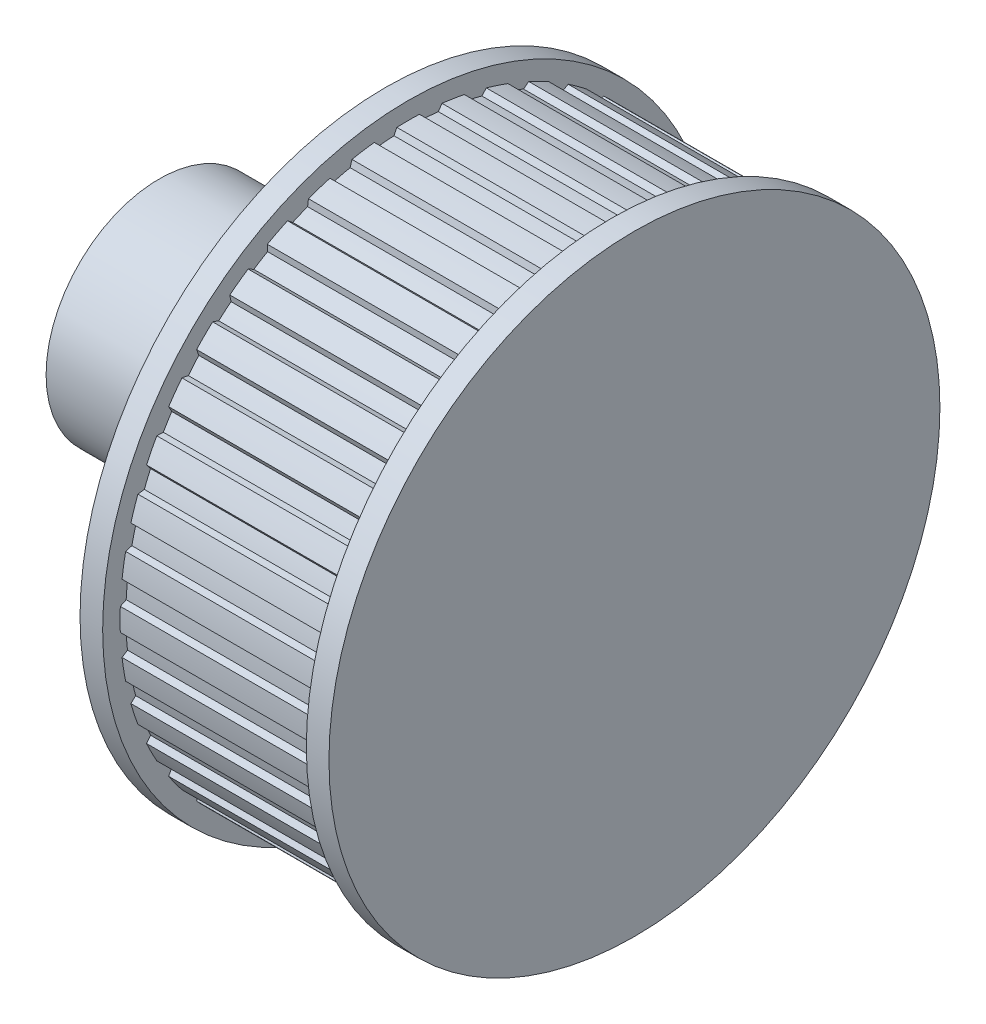
from build123d import *

# Parameters (mm, degrees)
BOSS_EXTRUDE1_DEPTH     = 9
SKETCH6_R               = 13.5
BOSS_EXTRUDE2_DEPTH     = 1
BOSS_EXTRUDE3_START     = -10
SKETCH6_3_R             = 13.5
BOSS_EXTRUDE3_DEPTH     = 1
SKETCH7_R               = 5
BOSS_EXTRUDE4_DEPTH     = 10
SKETCH8_R               = 3
CUT_EXTRUDE1_DEPTH      = 10
CUT_EXTRUDE2_REACH      = 27.407
CUT_EXTRUDE2_END_RADIUS = 3
SKETCH9_R               = 1.6


with BuildPart() as part:
    # Sketch5 → Boss-Extrude1 (new body)
    with BuildSketch(Plane(origin=(0, 0, 0), x_dir=(0, 0, -1), z_dir=(1, 0, 0))):
        with BuildLine():
            Line((-0.622813523, 12.459443339), (-0.499777455, 12.720185631))
            ThreePointArc((-0.499777455, 12.720185631), (0, 12.73), (0.499777455, 12.720185631))
            Line((0.499777455, 12.720185631), (0.622813523, 12.459443339))
            ThreePointArc((0.622813523, 12.459443339), (0.978777219, 12.436543738), (1.333940698, 12.403476416))
            Line((1.333940698, 12.403476416), (1.49625107, 12.641761457))
            ThreePointArc((1.49625107, 12.641761457), (1.99141074, 12.573272576), (2.483499799, 12.48539662))
            Line((2.483499799, 12.48539662), (2.564232009, 12.208617416))
            ThreePointArc((2.564232009, 12.208617416), (2.912230914, 12.130314757), (3.257848872, 12.04209474))
            Line((3.257848872, 12.04209474), (3.455436927, 12.25205516))
            ThreePointArc((3.455436927, 12.25205516), (3.933786338, 12.106949452), (4.406070137, 11.943175706))
            Line((4.406070137, 11.943175706), (4.442510592, 11.657174814))
            ThreePointArc((4.442510592, 11.657174814), (4.773975819, 11.525397168), (5.101537995, 11.384196725))
            Line((5.101537995, 11.384196725), (5.329538459, 11.560662603))
            ThreePointArc((5.329538459, 11.560662603), (5.779299062, 11.342513053), (6.220148404, 11.10687417))
            Line((6.220148404, 11.10687417), (6.211399821, 10.81869388))
            ThreePointArc((6.211399821, 10.81869388), (6.518169595, 10.63668605), (6.819610322, 10.445982006))
            Line((6.819610322, 10.445982006), (7.072409066, 10.584608165))
            ThreePointArc((7.072409066, 10.584608165), (7.482506262, 10.298786338), (7.881065975, 9.99708453))
            Line((7.881065975, 9.99708453), (7.827343771, 9.713820798))
            ThreePointArc((7.827343771, 9.713820798), (8.101864403, 9.486064421), (8.369761209, 9.250552541))
            Line((8.369761209, 9.250552541), (8.641133491, 9.347925545))
            ThreePointArc((8.641133491, 9.347925545), (9.001469325, 9.001469325), (9.347925545, 8.641133491))
            Line((9.347925545, 8.641133491), (9.250552541, 8.369761209))
            ThreePointArc((9.250552541, 8.369761209), (9.486064421, 8.101864403), (9.713820798, 7.827343771))
            Line((9.713820798, 7.827343771), (9.99708453, 7.881065975))
            ThreePointArc((9.99708453, 7.881065975), (10.298786338, 7.482506262), (10.584608165, 7.072409066))
            Line((10.584608165, 7.072409066), (10.445982006, 6.819610322))
            ThreePointArc((10.445982006, 6.819610322), (10.63668605, 6.518169595), (10.81869388, 6.211399821))
            Line((10.81869388, 6.211399821), (11.10687417, 6.220148404))
            ThreePointArc((11.10687417, 6.220148404), (11.342513053, 5.779299062), (11.560662603, 5.329538459))
            Line((11.560662603, 5.329538459), (11.384196725, 5.101537995))
            ThreePointArc((11.384196725, 5.101537995), (11.525397168, 4.773975819), (11.657174814, 4.442510592))
            Line((11.657174814, 4.442510592), (11.943175706, 4.406070137))
            ThreePointArc((11.943175706, 4.406070137), (12.106949452, 3.933786338), (12.25205516, 3.455436927))
            Line((12.25205516, 3.455436927), (12.04209474, 3.257848872))
            ThreePointArc((12.04209474, 3.257848872), (12.130314757, 2.912230914), (12.208617416, 2.564232009))
            Line((12.208617416, 2.564232009), (12.48539662, 2.483499799))
            ThreePointArc((12.48539662, 2.483499799), (12.573272576, 1.99141074), (12.641761457, 1.49625107))
            Line((12.641761457, 1.49625107), (12.403476416, 1.333940698))
            ThreePointArc((12.403476416, 1.333940698), (12.436543738, 0.978777219), (12.459443339, 0.622813523))
            Line((12.459443339, 0.622813523), (12.720185631, 0.499777455))
            ThreePointArc((12.720185631, 0.499777455), (12.73, 0), (12.720185631, -0.499777455))
            Line((12.720185631, -0.499777455), (12.459443339, -0.622813523))
            ThreePointArc((12.459443339, -0.622813523), (12.436543738, -0.978777219), (12.403476416, -1.333940698))
            Line((12.403476416, -1.333940698), (12.641761457, -1.49625107))
            ThreePointArc((12.641761457, -1.49625107), (12.573272576, -1.99141074), (12.48539662, -2.483499799))
            Line((12.48539662, -2.483499799), (12.208617416, -2.564232009))
            ThreePointArc((12.208617416, -2.564232009), (12.130314757, -2.912230914), (12.04209474, -3.257848872))
            Line((12.04209474, -3.257848872), (12.25205516, -3.455436927))
            ThreePointArc((12.25205516, -3.455436927), (12.106949452, -3.933786338), (11.943175706, -4.406070137))
            Line((11.943175706, -4.406070137), (11.657174814, -4.442510592))
            ThreePointArc((11.657174814, -4.442510592), (11.525397168, -4.773975819), (11.384196725, -5.101537995))
            Line((11.384196725, -5.101537995), (11.560662603, -5.329538459))
            ThreePointArc((11.560662603, -5.329538459), (11.342513053, -5.779299062), (11.10687417, -6.220148404))
            Line((11.10687417, -6.220148404), (10.81869388, -6.211399821))
            ThreePointArc((10.81869388, -6.211399821), (10.63668605, -6.518169595), (10.445982006, -6.819610322))
            Line((10.445982006, -6.819610322), (10.584608165, -7.072409066))
            ThreePointArc((10.584608165, -7.072409066), (10.298786338, -7.482506262), (9.99708453, -7.881065975))
            Line((9.99708453, -7.881065975), (9.713820798, -7.827343771))
            ThreePointArc((9.713820798, -7.827343771), (9.486064421, -8.101864403), (9.250552541, -8.369761209))
            Line((9.250552541, -8.369761209), (9.347925545, -8.641133491))
            ThreePointArc((9.347925545, -8.641133491), (9.001469325, -9.001469325), (8.641133491, -9.347925545))
            Line((8.641133491, -9.347925545), (8.369761209, -9.250552541))
            ThreePointArc((8.369761209, -9.250552541), (8.101864403, -9.486064421), (7.827343771, -9.713820798))
            Line((7.827343771, -9.713820798), (7.881065975, -9.99708453))
            ThreePointArc((7.881065975, -9.99708453), (7.482506262, -10.298786338), (7.072409066, -10.584608165))
            Line((7.072409066, -10.584608165), (6.819610322, -10.445982006))
            ThreePointArc((6.819610322, -10.445982006), (6.518169595, -10.63668605), (6.211399821, -10.81869388))
            Line((6.211399821, -10.81869388), (6.220148404, -11.10687417))
            ThreePointArc((6.220148404, -11.10687417), (5.779299062, -11.342513053), (5.329538459, -11.560662603))
            Line((5.329538459, -11.560662603), (5.101537995, -11.384196725))
            ThreePointArc((5.101537995, -11.384196725), (4.773975819, -11.525397168), (4.442510592, -11.657174814))
            Line((4.442510592, -11.657174814), (4.406070137, -11.943175706))
            ThreePointArc((4.406070137, -11.943175706), (3.933786338, -12.106949452), (3.455436927, -12.25205516))
            Line((3.455436927, -12.25205516), (3.257848872, -12.04209474))
            ThreePointArc((3.257848872, -12.04209474), (2.912230914, -12.130314757), (2.564232009, -12.208617416))
            Line((2.564232009, -12.208617416), (2.483499799, -12.48539662))
            ThreePointArc((2.483499799, -12.48539662), (1.99141074, -12.573272576), (1.49625107, -12.641761457))
            Line((1.49625107, -12.641761457), (1.333940698, -12.403476416))
            ThreePointArc((1.333940698, -12.403476416), (0.978777219, -12.436543738), (0.622813523, -12.459443339))
            Line((0.622813523, -12.459443339), (0.499777455, -12.720185631))
            ThreePointArc((0.499777455, -12.720185631), (0, -12.73), (-0.499777455, -12.720185631))
            Line((-0.499777455, -12.720185631), (-0.622813523, -12.459443339))
            ThreePointArc((-0.622813523, -12.459443339), (-0.978777219, -12.436543738), (-1.333940698, -12.403476416))
            Line((-1.333940698, -12.403476416), (-1.49625107, -12.641761457))
            ThreePointArc((-1.49625107, -12.641761457), (-1.99141074, -12.573272576), (-2.483499799, -12.48539662))
            Line((-2.483499799, -12.48539662), (-2.564232009, -12.208617416))
            ThreePointArc((-2.564232009, -12.208617416), (-2.912230914, -12.130314757), (-3.257848872, -12.04209474))
            Line((-3.257848872, -12.04209474), (-3.455436927, -12.25205516))
            ThreePointArc((-3.455436927, -12.25205516), (-3.933786338, -12.106949452), (-4.406070137, -11.943175706))
            Line((-4.406070137, -11.943175706), (-4.442510592, -11.657174814))
            ThreePointArc((-4.442510592, -11.657174814), (-4.773975819, -11.525397168), (-5.101537995, -11.384196725))
            Line((-5.101537995, -11.384196725), (-5.329538459, -11.560662603))
            ThreePointArc((-5.329538459, -11.560662603), (-5.779299062, -11.342513053), (-6.220148404, -11.10687417))
            Line((-6.220148404, -11.10687417), (-6.211399821, -10.81869388))
            ThreePointArc((-6.211399821, -10.81869388), (-6.518169595, -10.63668605), (-6.819610322, -10.445982006))
            Line((-6.819610322, -10.445982006), (-7.072409066, -10.584608165))
            ThreePointArc((-7.072409066, -10.584608165), (-7.482506262, -10.298786338), (-7.881065975, -9.99708453))
            Line((-7.881065975, -9.99708453), (-7.827343771, -9.713820798))
            ThreePointArc((-7.827343771, -9.713820798), (-8.101864403, -9.486064421), (-8.369761209, -9.250552541))
            Line((-8.369761209, -9.250552541), (-8.641133491, -9.347925545))
            ThreePointArc((-8.641133491, -9.347925545), (-9.001469325, -9.001469325), (-9.347925545, -8.641133491))
            Line((-9.347925545, -8.641133491), (-9.250552541, -8.369761209))
            ThreePointArc((-9.250552541, -8.369761209), (-9.486064421, -8.101864403), (-9.713820798, -7.827343771))
            Line((-9.713820798, -7.827343771), (-9.99708453, -7.881065975))
            ThreePointArc((-9.99708453, -7.881065975), (-10.298786338, -7.482506262), (-10.584608165, -7.072409066))
            Line((-10.584608165, -7.072409066), (-10.445982006, -6.819610322))
            ThreePointArc((-10.445982006, -6.819610322), (-10.63668605, -6.518169595), (-10.81869388, -6.211399821))
            Line((-10.81869388, -6.211399821), (-11.10687417, -6.220148404))
            ThreePointArc((-11.10687417, -6.220148404), (-11.342513053, -5.779299062), (-11.560662603, -5.329538459))
            Line((-11.560662603, -5.329538459), (-11.384196725, -5.101537995))
            ThreePointArc((-11.384196725, -5.101537995), (-11.525397168, -4.773975819), (-11.657174814, -4.442510592))
            Line((-11.657174814, -4.442510592), (-11.943175706, -4.406070137))
            ThreePointArc((-11.943175706, -4.406070137), (-12.106949452, -3.933786338), (-12.25205516, -3.455436927))
            Line((-12.25205516, -3.455436927), (-12.04209474, -3.257848872))
            ThreePointArc((-12.04209474, -3.257848872), (-12.130314757, -2.912230914), (-12.208617416, -2.564232009))
            Line((-12.208617416, -2.564232009), (-12.48539662, -2.483499799))
            ThreePointArc((-12.48539662, -2.483499799), (-12.573272576, -1.99141074), (-12.641761457, -1.49625107))
            Line((-12.641761457, -1.49625107), (-12.403476416, -1.333940698))
            ThreePointArc((-12.403476416, -1.333940698), (-12.436543738, -0.978777219), (-12.459443339, -0.622813523))
            Line((-12.459443339, -0.622813523), (-12.720185631, -0.499777455))
            ThreePointArc((-12.720185631, -0.499777455), (-12.73, 0), (-12.720185631, 0.499777455))
            Line((-12.720185631, 0.499777455), (-12.459443339, 0.622813523))
            ThreePointArc((-12.459443339, 0.622813523), (-12.436543738, 0.978777219), (-12.403476416, 1.333940698))
            Line((-12.403476416, 1.333940698), (-12.641761457, 1.49625107))
            ThreePointArc((-12.641761457, 1.49625107), (-12.573272576, 1.99141074), (-12.48539662, 2.483499799))
            Line((-12.48539662, 2.483499799), (-12.208617416, 2.564232009))
            ThreePointArc((-12.208617416, 2.564232009), (-12.130314757, 2.912230914), (-12.04209474, 3.257848872))
            Line((-12.04209474, 3.257848872), (-12.25205516, 3.455436927))
            ThreePointArc((-12.25205516, 3.455436927), (-12.106949452, 3.933786338), (-11.943175706, 4.406070137))
            Line((-11.943175706, 4.406070137), (-11.657174814, 4.442510592))
            ThreePointArc((-11.657174814, 4.442510592), (-11.525397168, 4.773975819), (-11.384196725, 5.101537995))
            Line((-11.384196725, 5.101537995), (-11.560662603, 5.329538459))
            ThreePointArc((-11.560662603, 5.329538459), (-11.342513053, 5.779299062), (-11.10687417, 6.220148404))
            Line((-11.10687417, 6.220148404), (-10.81869388, 6.211399821))
            ThreePointArc((-10.81869388, 6.211399821), (-10.63668605, 6.518169595), (-10.445982006, 6.819610322))
            Line((-10.445982006, 6.819610322), (-10.584608165, 7.072409066))
            ThreePointArc((-10.584608165, 7.072409066), (-10.298786338, 7.482506262), (-9.99708453, 7.881065975))
            Line((-9.99708453, 7.881065975), (-9.713820798, 7.827343771))
            ThreePointArc((-9.713820798, 7.827343771), (-9.486064421, 8.101864403), (-9.250552541, 8.369761209))
            Line((-9.250552541, 8.369761209), (-9.347925545, 8.641133491))
            ThreePointArc((-9.347925545, 8.641133491), (-9.001469325, 9.001469325), (-8.641133491, 9.347925545))
            Line((-8.641133491, 9.347925545), (-8.369761209, 9.250552541))
            ThreePointArc((-8.369761209, 9.250552541), (-8.101864403, 9.486064421), (-7.827343771, 9.713820798))
            Line((-7.827343771, 9.713820798), (-7.881065975, 9.99708453))
            ThreePointArc((-7.881065975, 9.99708453), (-7.482506262, 10.298786338), (-7.072409066, 10.584608165))
            Line((-7.072409066, 10.584608165), (-6.819610322, 10.445982006))
            ThreePointArc((-6.819610322, 10.445982006), (-6.518169595, 10.63668605), (-6.211399821, 10.81869388))
            Line((-6.211399821, 10.81869388), (-6.220148404, 11.10687417))
            ThreePointArc((-6.220148404, 11.10687417), (-5.779299062, 11.342513053), (-5.329538459, 11.560662603))
            Line((-5.329538459, 11.560662603), (-5.101537995, 11.384196725))
            ThreePointArc((-5.101537995, 11.384196725), (-4.773975819, 11.525397168), (-4.442510592, 11.657174814))
            Line((-4.442510592, 11.657174814), (-4.406070137, 11.943175706))
            ThreePointArc((-4.406070137, 11.943175706), (-3.933786338, 12.106949452), (-3.455436927, 12.25205516))
            Line((-3.455436927, 12.25205516), (-3.257848872, 12.04209474))
            ThreePointArc((-3.257848872, 12.04209474), (-2.912230914, 12.130314757), (-2.564232009, 12.208617416))
            Line((-2.564232009, 12.208617416), (-2.483499799, 12.48539662))
            ThreePointArc((-2.483499799, 12.48539662), (-1.99141074, 12.573272576), (-1.49625107, 12.641761457))
            Line((-1.49625107, 12.641761457), (-1.333940698, 12.403476416))
            ThreePointArc((-1.333940698, 12.403476416), (-0.978777219, 12.436543738), (-0.622813523, 12.459443339))
        make_face()
    extrude(amount=BOSS_EXTRUDE1_DEPTH)

    # Sketch6 → Boss-Extrude2 (add)
    with BuildSketch(Plane(origin=(9, 0, 0), x_dir=(0, 0, -1), z_dir=(1, 0, 0))):
        Circle(SKETCH6_R)
    extrude(amount=BOSS_EXTRUDE2_DEPTH)

    # Sketch6<3> → Boss-Extrude3 (add)
    with BuildSketch(Plane(origin=(9, 0, 0), x_dir=(0, 0, -1), z_dir=(1, 0, 0)).offset(BOSS_EXTRUDE3_START)):
        Circle(SKETCH6_3_R)
    extrude(amount=BOSS_EXTRUDE3_DEPTH)

    # Sketch7 → Boss-Extrude4 (add)
    with BuildSketch(Plane.ZY.offset(1)):
        Circle(SKETCH7_R)
    extrude(amount=BOSS_EXTRUDE4_DEPTH)

    # Sketch8 → Cut-Extrude1 (cut)
    with BuildSketch(Plane.ZY.offset(11)):
        Circle(SKETCH8_R)
    extrude(amount=-CUT_EXTRUDE1_DEPTH, mode=Mode.SUBTRACT)

    # Cut-Extrude2: up to this cylinder (the profile starts outside it)
    cut_extrude2_end = Plane(origin=(-6, 0, 0), z_dir=(-1, 0, 0)) * Cylinder(CUT_EXTRUDE2_END_RADIUS, 61.814, mode=Mode.PRIVATE)
    # Sketch9 → Cut-Extrude2 (cut, up to the surface)
    with BuildSketch(Plane(origin=(0, 5, 0), x_dir=(1, 0, 0), z_dir=(0, 1, 0)), mode=Mode.PRIVATE) as cut_extrude2_sk1:
        with Locations(Location((-6, 0, 0), (0, 0, 270))):
            Circle(SKETCH9_R)
    cut_extrude2_tool1 = extrude(cut_extrude2_sk1.sketch, amount=-CUT_EXTRUDE2_REACH, mode=Mode.PRIVATE) - cut_extrude2_end
    add(cut_extrude2_tool1.solids().sort_by_distance((-6, 5, 0))[0], mode=Mode.SUBTRACT)


solid = part.part
